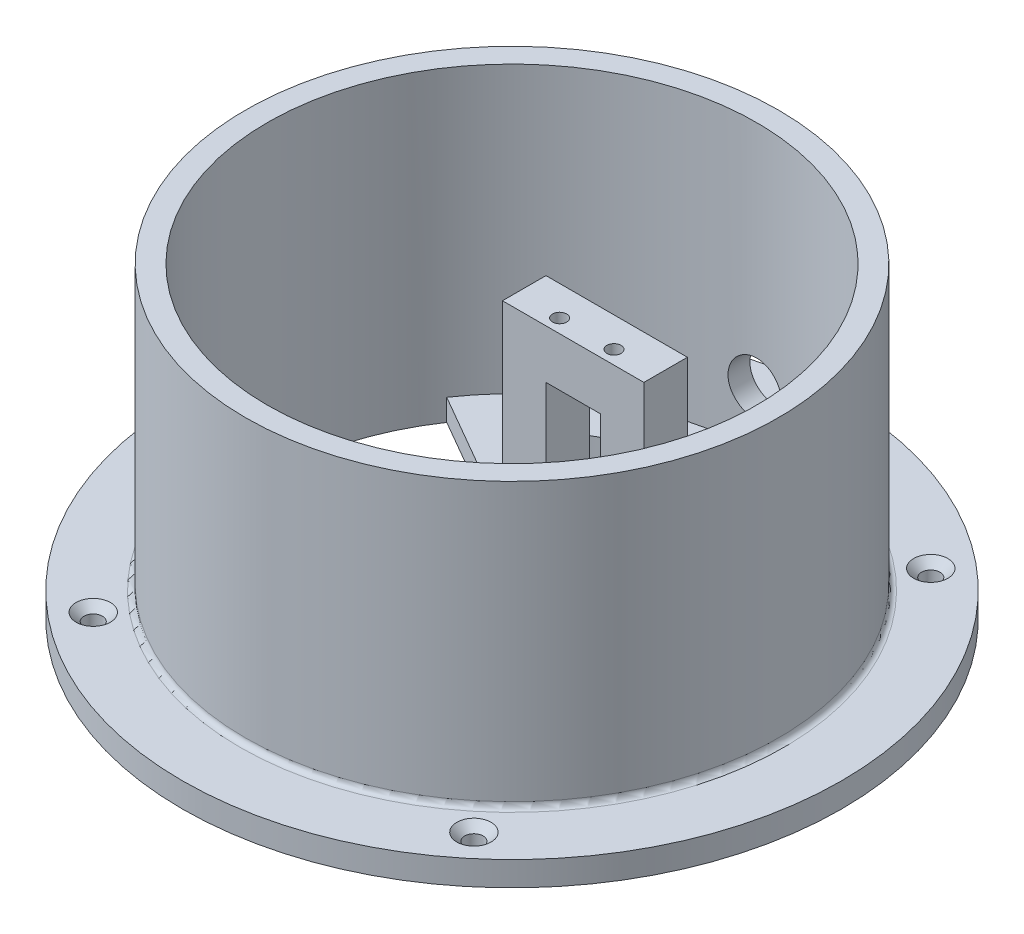
from build123d import *

# Parameters (mm, degrees)
SKETCH2_R                                           = 60.625
SKETCH2_R_2                                         = 45
BOSS_EXTRUDE1_DEPTH                                 = 4.5
SKETCH3_R                                           = 49
SKETCH3_R_2                                         = 45
BOSS_EXTRUDE2_DEPTH                                 = 52
SKETCH4_W                                           = 13.25
SKETCH4_H                                           = 8
SKETCH4_W_2                                         = 8
SKETCH4_H_2                                         = 38.5
BOSS_EXTRUDE3_DEPTH                                 = 13
SKETCH5_W                                           = 10
SKETCH5_H                                           = 20
CUT_EXTRUDE1_DEPTH                                  = 26
SKETCH6_R                                           = 5
CUT_EXTRUDE2_DEPTH                                  = 110.698023
SKETCH7_R                                           = 1.3
CUT_EXTRUDE3_DEPTH                                  = 7.2
BOSS_EXTRUDE4_DEPTH                                 = 4
CSK_FOR_M3_COUNTERSUNK_FLAT_HEAD_SCREW1_D           = 3.4
CSK_FOR_M3_COUNTERSUNK_FLAT_HEAD_SCREW1_DEPTH       = 44.45
CSK_FOR_M3_COUNTERSUNK_FLAT_HEAD_SCREW1_CSINK_D     = 6.3
CSK_FOR_M3_COUNTERSUNK_FLAT_HEAD_SCREW1_CSINK_ANGLE = 90
CSK_FOR_M3_COUNTERSUNK_FLAT_HEAD_SCREW1_TIP         = 1.021463052
FILLET1_R                                           = 1


with BuildPart() as part:
    # Sketch2 → Boss-Extrude1 (new body)
    with BuildSketch(Plane(origin=(0, 0, 0), x_dir=(1, 0, 0), z_dir=(0, 1, 0))):
        with Locations(Location((0, 0, 0), (0, 0, 270))):
            Circle(SKETCH2_R)
        with Locations(Location((0, 0, 0), (0, 0, 270))):
            Circle(SKETCH2_R_2, mode=Mode.SUBTRACT)
    extrude(amount=BOSS_EXTRUDE1_DEPTH)

    # Sketch3 → Boss-Extrude2 (add)
    with BuildSketch(Plane(origin=(0, 4.5, 0), x_dir=(1, 0, 0), z_dir=(0, 1, 0))):
        with Locations(Location((0, 0, 0), (0, 0, 90))):
            Circle(SKETCH3_R)
        with Locations(Location((0, 0, 0), (0, 0, 270))):
            Circle(SKETCH3_R_2, mode=Mode.SUBTRACT)
    extrude(amount=BOSS_EXTRUDE2_DEPTH)

    # Sketch4 → Boss-Extrude3 (add, symmetric)
    with BuildSketch(Plane(origin=(0, 0, 0), x_dir=(0, 0, -1), z_dir=(1, 0, 0))):
        Polygon((-31.75, 30.5), (-45, 30.5), (-45, 17.25), align=None)
        with Locations((-38.375, 34.5)):
            Rectangle(SKETCH4_W, SKETCH4_H)
        with Locations((15.25, 19.25)):
            Rectangle(SKETCH4_W_2, SKETCH4_H_2)
    extrude(amount=BOSS_EXTRUDE3_DEPTH, both=True)


with BuildPart() as boss_extrude3_piece_1:
    # of the separate pieces the step leaves, piece 1, a body of its own (boss_extrude3_pieces)
    add(part.part.solids().sort_by_distance((0, 0, 60.625))[0])


with BuildPart() as boss_extrude3_piece_2:
    # of the separate pieces the step leaves, piece 2, a body of its own (boss_extrude3_pieces)
    add(part.part.solids().sort_by_distance((-13, 38.5, -19.25))[0])

    # Sketch5 → Cut-Extrude1 (cut)
    with BuildSketch(Plane.XY):
        with Locations((0, 19.5)):
            Rectangle(SKETCH5_W, SKETCH5_H)
    extrude(amount=-CUT_EXTRUDE1_DEPTH, mode=Mode.SUBTRACT)


with BuildPart() as cut_extrude2_tool:
    # Sketch6 → Cut-Extrude2 (new, through all)
    with BuildSketch(Plane.XY.offset(-11.25)):
        with Locations(Location((0, 14, 0), (0, 0, 90))):
            Circle(SKETCH6_R)
    extrude(amount=-CUT_EXTRUDE2_DEPTH)


with BuildPart() as boss_extrude3_piece_1_1:
    add(boss_extrude3_piece_1.part)

    # Cut-Extrude2: cut by cut_extrude2_tool
    add(cut_extrude2_tool.part, mode=Mode.SUBTRACT)


with BuildPart() as boss_extrude3_piece_2_1:
    add(boss_extrude3_piece_2.part)

    # Cut-Extrude2: cut by cut_extrude2_tool
    add(cut_extrude2_tool.part, mode=Mode.SUBTRACT)


with BuildPart() as cut_extrude3_tool:
    # Sketch7 → Cut-Extrude3 (new body)
    with BuildSketch(Plane(origin=(0, 38.5, 0), x_dir=(1, 0, 0), z_dir=(0, 1, 0))):
        with Locations(Location((-5, 13.75, 0), (0, 0, 270))):
            Circle(SKETCH7_R)
        with Locations(Location((5, 13.75, 0), (0, 0, 270))):
            Circle(SKETCH7_R)
        with Locations(Location((-5, -34.25, 0), (0, 0, 270))):
            Circle(SKETCH7_R)
        with Locations(Location((5, -34.25, 0), (0, 0, 270))):
            Circle(SKETCH7_R)
    extrude(amount=-CUT_EXTRUDE3_DEPTH)


with BuildPart() as boss_extrude3_piece_1_2:
    add(boss_extrude3_piece_1_1.part)

    # Cut-Extrude3: cut by cut_extrude3_tool
    add(cut_extrude3_tool.part, mode=Mode.SUBTRACT)



with BuildPart() as boss_extrude3_piece_2_2:
    add(boss_extrude3_piece_2_1.part)

    # Cut-Extrude3: cut by cut_extrude3_tool
    add(cut_extrude3_tool.part, mode=Mode.SUBTRACT)


with BuildPart() as boss_extrude3_piece_1_3:
    add(boss_extrude3_piece_1_2.part)

    add(boss_extrude3_piece_2_2.part)  # Boss-Extrude4 merges Boss-Extrude3 piece 2
    # Sketch8 → Boss-Extrude4 (add)
    with BuildSketch(Plane.XZ):
        with BuildLine():
            Line((13, -11.25), (-13, -11.25))
            Line((-13, -11.25), (-37.248431585, -25.249838503))
            ThreePointArc((-37.248431585, -25.249838503), (0, -45), (37.248431585, -25.249838503))
            Line((37.248431585, -25.249838503), (13, -11.25))
        make_face()
        with BuildLine():
            Line((-19.516660498, -24.25), (-24.906460381, -27.361802413))
            ThreePointArc((-24.906460381, -27.361802413), (0, -37), (24.906460381, -27.361802413))
            Line((24.906460381, -27.361802413), (19.516660498, -24.25))
            Line((19.516660498, -24.25), (-19.516660498, -24.25))
        make_face(mode=Mode.SUBTRACT)
    extrude(amount=-BOSS_EXTRUDE4_DEPTH)

    # CSK for M3 Countersunk Flat Head Screw1
    with Locations(Plane(origin=(-35, 4.5, -42), x_dir=(0, 0, 1), z_dir=(0, 1, 0))):
        with Locations((0, 0), (0, 70), (84, 70), (84, 0)):
            CounterSinkHole(CSK_FOR_M3_COUNTERSUNK_FLAT_HEAD_SCREW1_D / 2, CSK_FOR_M3_COUNTERSUNK_FLAT_HEAD_SCREW1_CSINK_D / 2, depth=CSK_FOR_M3_COUNTERSUNK_FLAT_HEAD_SCREW1_DEPTH, counter_sink_angle=CSK_FOR_M3_COUNTERSUNK_FLAT_HEAD_SCREW1_CSINK_ANGLE)
            with Locations((0, 0, -(CSK_FOR_M3_COUNTERSUNK_FLAT_HEAD_SCREW1_DEPTH + CSK_FOR_M3_COUNTERSUNK_FLAT_HEAD_SCREW1_TIP / 2))):  # 118° drill point
                Cone(0, CSK_FOR_M3_COUNTERSUNK_FLAT_HEAD_SCREW1_D / 2, CSK_FOR_M3_COUNTERSUNK_FLAT_HEAD_SCREW1_TIP, mode=Mode.SUBTRACT)

    # Fillet1
    fillet1_edges = [boss_extrude3_piece_1_3.edges().sort_by_distance(p)[0] for p in [
        (0, 4.5, 49),
    ]]
    fillet(fillet1_edges, radius=FILLET1_R)


solid = boss_extrude3_piece_1_3.part
